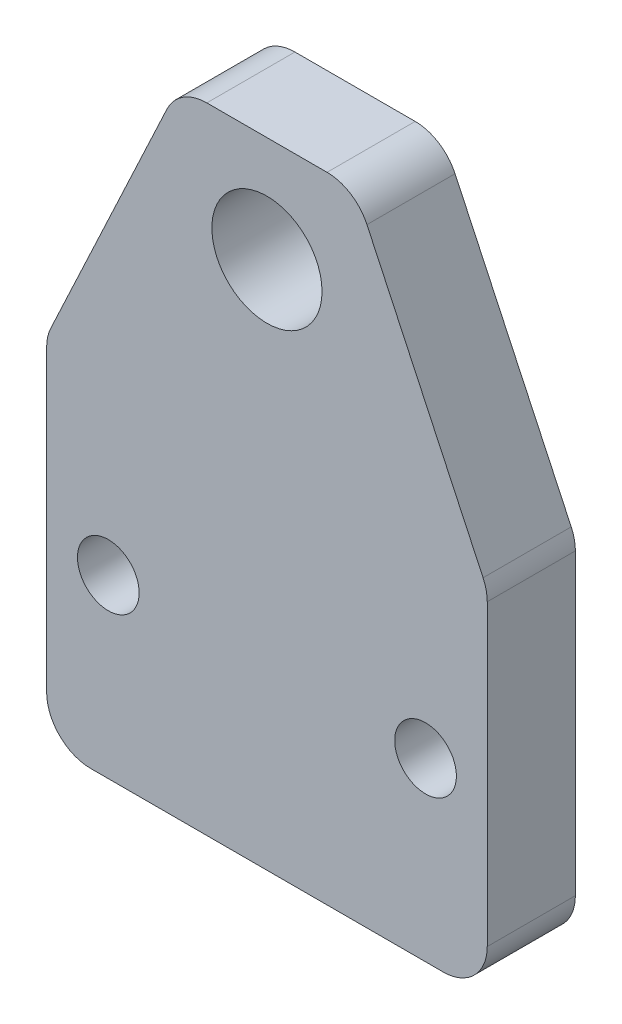
from build123d import *

# Parameters (mm, degrees)
BOSS_EXTRU_1_DEPTH           = 10
ENL_V_MAT_EXTRU_1_DEPTH      = 77.870020164
ENL_V_MAT_EXTRU_1_DEPTH_BACK = 77.870020164
ESQUISSE2_R                  = 3.5
CONG_1_R                     = 5
ESQUISSE3_R                  = 6.25
ENL_V_MAT_EXTRU_2_DEPTH      = 77.870020164


with BuildPart() as part:
    # Esquisse1 → Boss.-Extru.1 (new body)
    with BuildSketch(Plane.XY):
        Polygon((-25, 0), (25, 0), (25, 40), (10, 72), (-10, 72), (-25, 40), align=None)
    extrude(amount=BOSS_EXTRU_1_DEPTH)

    # Esquisse2 → Enlèv. mat.-Extru.1 (cut, two sides: drawn at the far end of the back side and taken through both)
    with BuildSketch(Plane.XY.offset(10).offset(-ENL_V_MAT_EXTRU_1_DEPTH_BACK)):
        with Locations((18, 20)):
            Circle(ESQUISSE2_R)
        with Locations((-18, 20)):
            Circle(ESQUISSE2_R)
    extrude(amount=ENL_V_MAT_EXTRU_1_DEPTH + ENL_V_MAT_EXTRU_1_DEPTH_BACK, mode=Mode.SUBTRACT)

    # Congé1
    cong_1_edges = [part.edges().sort_by_distance(p)[0] for p in [
        (25, 0, 5),
        (-25, 0, 5),
        (-25, 40, 5),
        (-10, 72, 5),
        (10, 72, 5),
        (25, 40, 5),
    ]]
    fillet(cong_1_edges, radius=CONG_1_R)

    # Esquisse3 → Enlèv. mat.-Extru.2 (cut, through all)
    with BuildSketch(Plane.XY.offset(10)):
        with Locations((0, 60)):
            Circle(ESQUISSE3_R)
    extrude(amount=-ENL_V_MAT_EXTRU_2_DEPTH, mode=Mode.SUBTRACT)


solid = part.part
